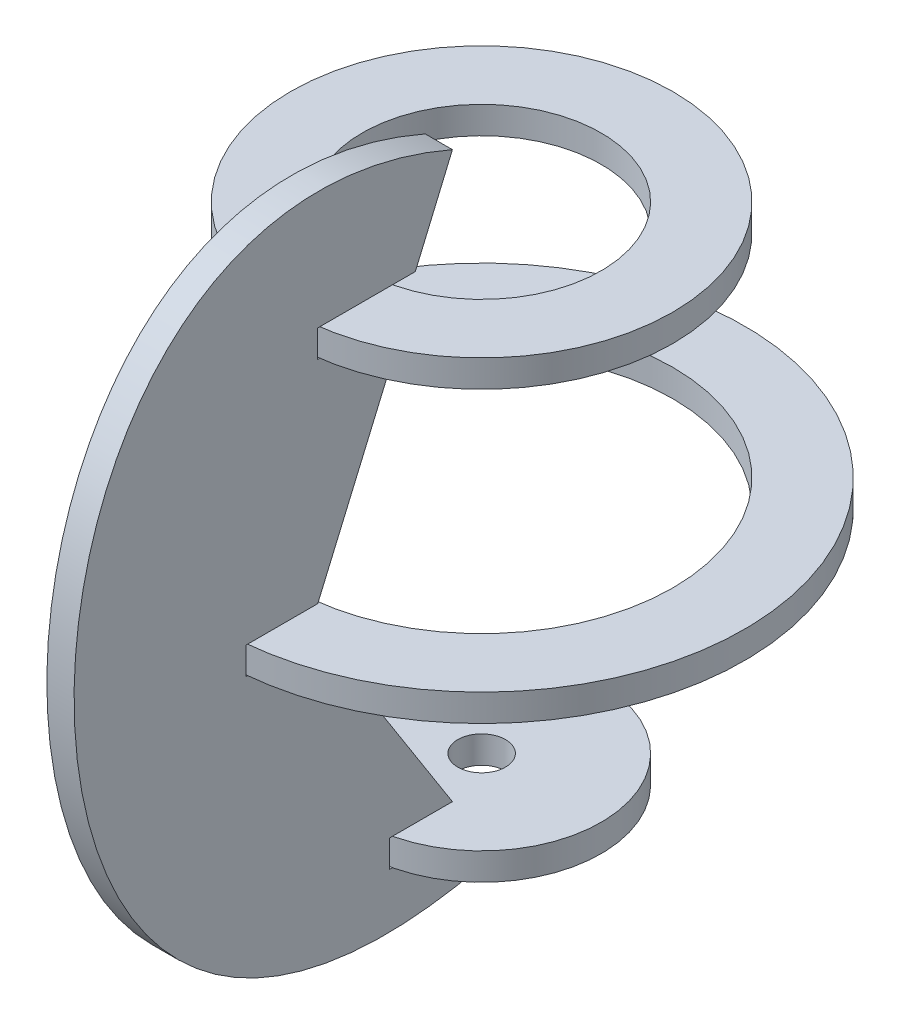
from build123d import *

# Parameters (mm, degrees)
SCHIZZO2_R                    = 25.0225
SCHIZZO2_R_2                  = 5
ESTRUSIONE_ESTRUSIONE1_DEPTH  = 5.7
SCHIZZO3_R                    = 55.0225
SCHIZZO3_R_2                  = 40.0225
ESTRUSIONE_ESTRUSIONE2_DEPTH  = 5.7
SCHIZZO4_R                    = 40.0225
SCHIZZO4_R_2                  = 25.0225
ESTRUSIONE_ESTRUSIONE3_DEPTH  = 5.7
ESTRUSIONE_ESTRUSIONE10_DEPTH = 5.7


with BuildPart() as part:
    # Schizzo2 → Estrusione-Estrusione1 (new body)
    with BuildSketch(Plane(origin=(0, 0, 0), x_dir=(1, 0, 0), z_dir=(0, 1, 0))):
        with Locations(Location((0, 0, 0), (0, 0, 270))):
            Circle(SCHIZZO2_R)
        with Locations(Location((0, 0, 0), (0, 0, 270))):
            Circle(SCHIZZO2_R_2, mode=Mode.SUBTRACT)
    extrude(amount=ESTRUSIONE_ESTRUSIONE1_DEPTH)


with BuildPart() as body_2:
    # Schizzo3 → Estrusione-Estrusione2 (new body)
    with BuildSketch(Plane(origin=(0, 50, 0), x_dir=(1, 0, 0), z_dir=(0, 1, 0))):
        with Locations(Location((0, 0, 0), (0, 0, 270))):
            Circle(SCHIZZO3_R)
        with Locations(Location((0, 0, 0), (0, 0, 270))):
            Circle(SCHIZZO3_R_2, mode=Mode.SUBTRACT)
    extrude(amount=ESTRUSIONE_ESTRUSIONE2_DEPTH)


with BuildPart() as body_3:
    # Schizzo4 → Estrusione-Estrusione3 (new body)
    with BuildSketch(Plane(origin=(0, 100, 0), x_dir=(1, 0, 0), z_dir=(0, 1, 0))):
        with Locations(Location((0, 0, 0), (0, 0, 270))):
            Circle(SCHIZZO4_R)
        with Locations(Location((0, 0, 0), (0, 0, 270))):
            Circle(SCHIZZO4_R_2, mode=Mode.SUBTRACT)
    extrude(amount=ESTRUSIONE_ESTRUSIONE3_DEPTH)


with BuildPart() as body_4:
    # Schizzo5 → Estrusione-Estrusione10 (new body)
    with BuildSketch(Plane(origin=(0, 0, 0), x_dir=(0, 0, -1), z_dir=(1, 0, 0))):
        with BuildLine():
            Line((-5, 0), (-5, -8.774122143))
            add(Edge.make_bspline(
                [(-5, -8.774122143), (-122.039878304, -36.784583812), (-115.130671173, 169.022277049), (-11.818324795, 123.928781979)],
                knots=[0, 0, 0, 0, 1, 1, 1, 1], degree=3))
            Line((-11.818324795, 123.928781979), (-19.584652517, 105.7))
            Line((-19.584652517, 105.7), (-40.0225, 105.7))
            Line((-40.0225, 105.7), (-40.0225, 100))
            Line((-40.0225, 100), (-20.998922906, 100))
            Line((-20.998922906, 100), (-40.0225, 55.7))
            Line((-40.0225, 55.7), (-55.0225, 55.7))
            Line((-55.0225, 55.7), (-55.0225, 50))
            Line((-55.0225, 50), (-40.0225, 50.008559229))
            Line((-40.0225, 50.008559229), (-11.818324795, 5.7))
            Line((-11.818324795, 5.7), (-25.0225, 5.7))
            Line((-25.0225, 5.7), (-25.0225, 0))
            Line((-25.0225, 0), (-5, 0))
        make_face()
    extrude(amount=ESTRUSIONE_ESTRUSIONE10_DEPTH)


solid = Compound([part.part, body_2.part, body_3.part, body_4.part])
